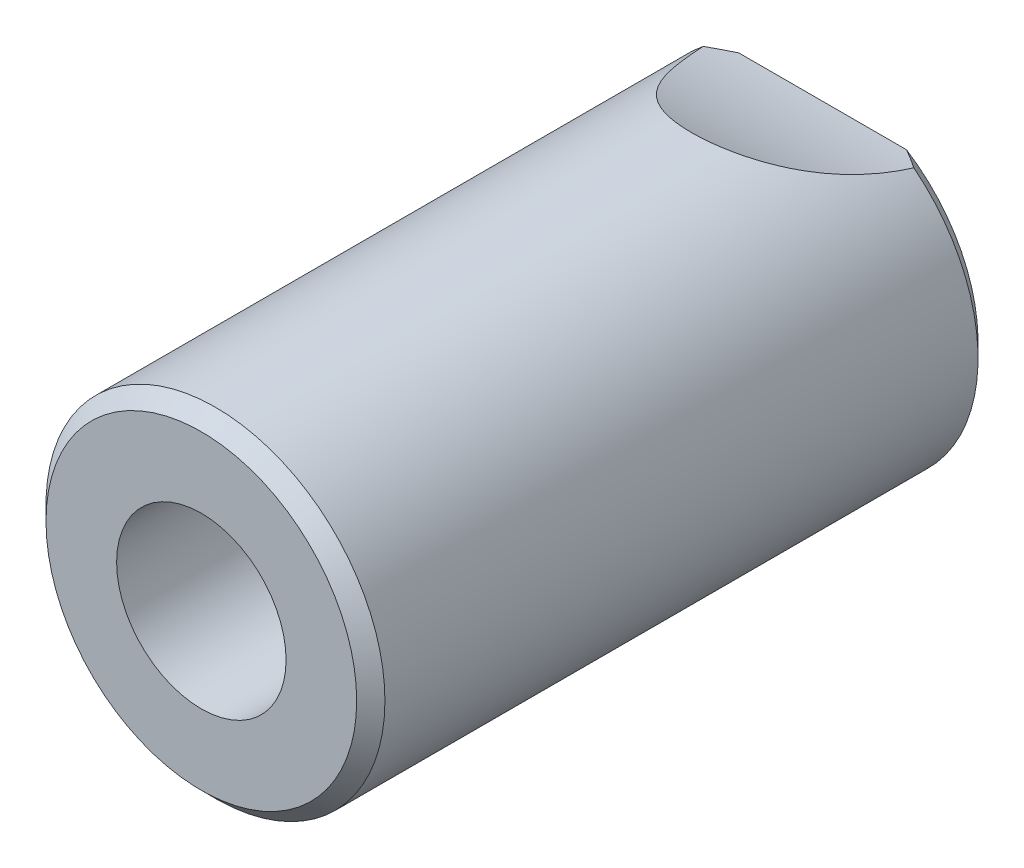
from build123d import *

# Parameters (mm, degrees)
SKETCH_1_R               = 12
EXTRUDE_1_DEPTH          = 44
CUT_EXTRUDE_1_DEPTH      = 48.15930449
CUT_EXTRUDE_1_DEPTH_BACK = 48.15930449
SKETCH_2_R               = 6
CHAMFER_1_SIZE           = 1
CUT_EXTRUDE_2_DEPTH      = 48.15930449
CUT_EXTRUDE_2_DEPTH_BACK = 48.15930449


with BuildPart() as part:
    # 草图1 → 凸台-拉伸1 (new body)
    with BuildSketch(Plane.XY):
        Circle(SKETCH_1_R)
    extrude(amount=EXTRUDE_1_DEPTH)

    # 草图2 → 切除-拉伸1 (cut, two sides: drawn at the far end of the back side and taken through both)
    with BuildSketch(Plane.XY.offset(44).offset(-CUT_EXTRUDE_1_DEPTH_BACK)):
        Circle(SKETCH_2_R)
    extrude(amount=CUT_EXTRUDE_1_DEPTH + CUT_EXTRUDE_1_DEPTH_BACK, mode=Mode.SUBTRACT)

    # 倒角1
    chamfer_1_edges = [part.edges().sort_by_distance(p)[0] for p in [
        (-12, 0, 0),
        (-12, 0, 44),
    ]]
    chamfer(chamfer_1_edges, length=CHAMFER_1_SIZE)

    # 草图3 → 切除-拉伸2 (cut, two sides: drawn at the far end of the back side and taken through both)
    with BuildSketch(Plane(origin=(0, 0, 0), x_dir=(0, 0, -1), z_dir=(1, 0, 0)).offset(-CUT_EXTRUDE_2_DEPTH_BACK)):
        with BuildLine():
            Line((-62.986172875, 133.10063067), (-25.120459682, 29.369909319))
            ThreePointArc((-25.120459682, 29.369909319), (-14.752953683, 15.315455683), (1.566572924, 9.095656735))
            Line((1.566572924, 9.095656735), (111.651710823, 0.427484986))
            Line((111.651710823, 0.427484986), (245.252446132, 176.286356459))
            Line((245.252446132, 176.286356459), (70.614562433, 308.959502143))
            Line((70.614562433, 308.959502143), (-62.986172875, 133.10063067))
        make_face()
    extrude(amount=CUT_EXTRUDE_2_DEPTH + CUT_EXTRUDE_2_DEPTH_BACK, mode=Mode.SUBTRACT)


solid = part.part
